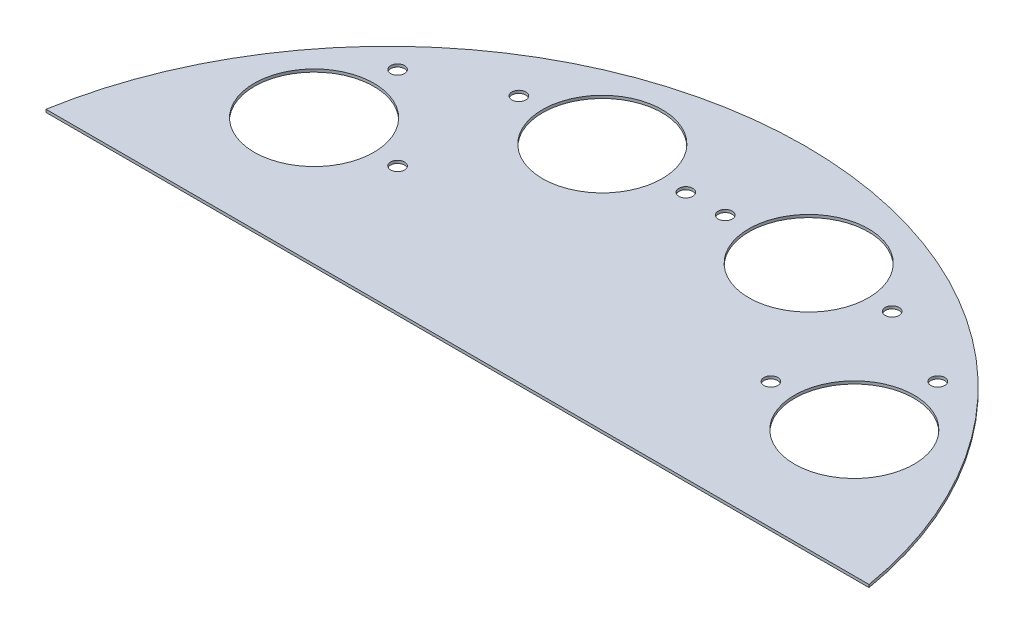
from build123d import *

# Parameters (mm, degrees)
SKETCH3_R             = 21.5
BOSS_EXTRUDE3_DEPTH   = 1
F_5_0MM_DOWEL_HOLE1_D = 5


with BuildPart() as part:
    # Sketch3 → Boss-Extrude3 (new body)
    with BuildSketch(Plane(origin=(0, 0, 0), x_dir=(1, 0, 0), z_dir=(0, 1, 0))):
        with BuildLine():
            Line((-147.74649939, -18.972612677), (148.057489765, -18.972612677))
            ThreePointArc((148.057489765, -18.972612677), (0.155495187, 106.027387323), (-147.74649939, -18.972612677))
        make_face()
        with Locations(Location((-96.926544138, 26.561617598, 0), (0, 0, 270))):
            Circle(SKETCH3_R, mode=Mode.SUBTRACT)
        with Locations(Location((97.237534512, 26.561617598, 0), (0, 0, 270))):
            Circle(SKETCH3_R, mode=Mode.SUBTRACT)
        with Locations(Location((-36.926544138, 70.154169278, 0), (0, 0, 270))):
            Circle(SKETCH3_R, mode=Mode.SUBTRACT)
        with Locations(Location((37.237534512, 70.154169278, 0), (0, 0, 270))):
            Circle(SKETCH3_R, mode=Mode.SUBTRACT)
    extrude(amount=BOSS_EXTRUDE3_DEPTH)

    # Ø5.0mm Dowel Hole1 (through all)
    with Locations(Plane(origin=(0, 0, 0), x_dir=(-1, 0, 0), z_dir=(0, -1, 0))):
        with Locations((-97.237534512, 56.561617598), (-67.237534512, 26.561617598), (-67.237534512, 70.154169278), (-7.237534512, 70.154169278), (6.926544138, 70.154169278), (66.926544138, 70.154169278), (96.926544138, 56.561617598), (66.926544138, 26.561617598)):
            Hole(F_5_0MM_DOWEL_HOLE1_D / 2)


solid = part.part
